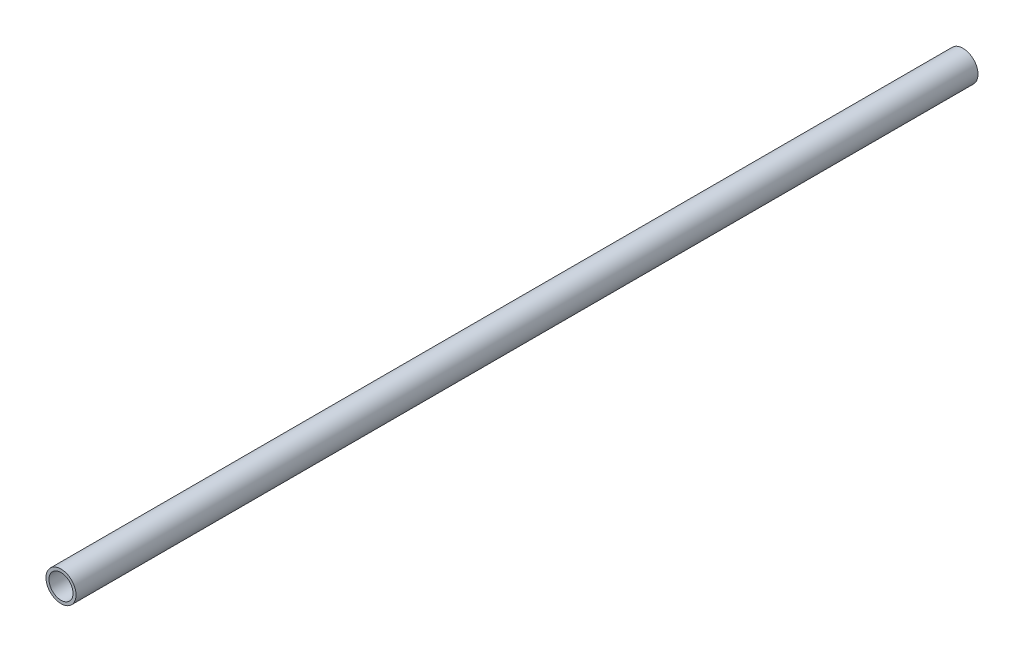
from build123d import *

# Parameters (mm, degrees)
SKETCH_1_R      = 5
SKETCH_1_R_2    = 4
EXTRUDE_1_DEPTH = 300


with BuildPart() as part:
    # ｽｹｯﾁ1 → ﾎﾞｽ - 押し出し1 (new body)
    with BuildSketch(Plane.XY):
        Circle(SKETCH_1_R)
        Circle(SKETCH_1_R_2, mode=Mode.SUBTRACT)
    extrude(amount=EXTRUDE_1_DEPTH)


solid = part.part
